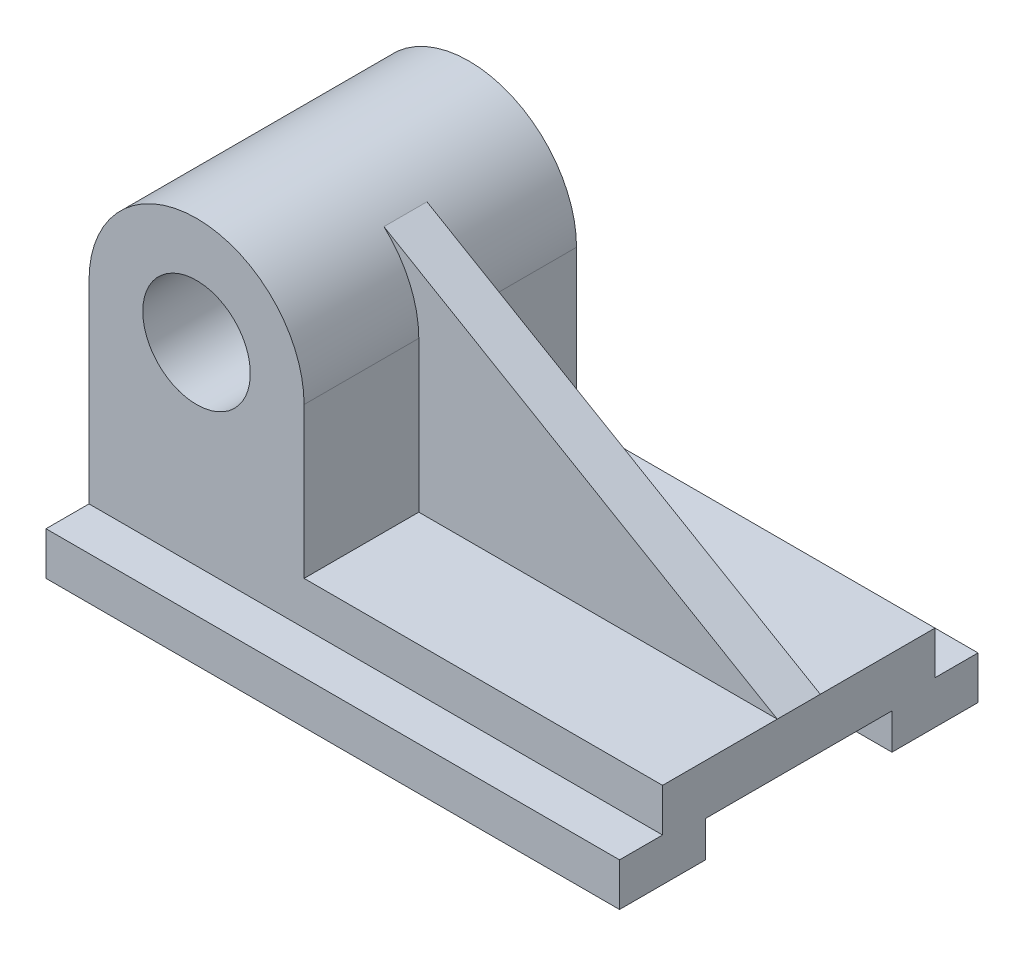
from build123d import *

# Parameters (mm, degrees)
SKETCH1_W                = 160
SKETCH1_H                = 100
BOSS_EXTRUDE2_DEPTH      = 24
SKETCH3_W                = 52
SKETCH3_H                = 10
CUT_EXTRUDE1_DEPTH       = 160
SKETCH4_W                = 12
SKETCH4_H                = 12
CUT_EXTRUDE2_DEPTH       = 160
SKETCH5_W                = 12
SKETCH5_H                = 12
CUT_EXTRUDE3_DEPTH       = 160
SKETCH6_R                = 15
BOSS_EXTRUDE3_DEPTH      = 76
BOSS_EXTRUDE4_DEPTH      = 6
BOSS_EXTRUDE4_DEPTH_BACK = 6


with BuildPart() as part:
    # Sketch1 → Boss-Extrude2 (new body)
    with BuildSketch(Plane(origin=(0, 0, 0), x_dir=(1, 0, 0), z_dir=(0, 1, 0))):
        Rectangle(SKETCH1_W, SKETCH1_H)
    extrude(amount=BOSS_EXTRUDE2_DEPTH)

    # Sketch3 → Cut-Extrude1 (cut)
    with BuildSketch(Plane(origin=(80, 0, 0), x_dir=(0, 0, -1), z_dir=(1, 0, 0))):
        with Locations((0, 5)):
            Rectangle(SKETCH3_W, SKETCH3_H)
    extrude(amount=-CUT_EXTRUDE1_DEPTH, mode=Mode.SUBTRACT)

    # Sketch4 → Cut-Extrude2 (cut)
    with BuildSketch(Plane(origin=(80, 0, 0), x_dir=(0, 0, -1), z_dir=(1, 0, 0))):
        with Locations((44, 18)):
            Rectangle(SKETCH4_W, SKETCH4_H)
    extrude(amount=-CUT_EXTRUDE2_DEPTH, mode=Mode.SUBTRACT)

    # Sketch5 → Cut-Extrude3 (cut)
    with BuildSketch(Plane(origin=(80, 0, 0), x_dir=(0, 0, -1), z_dir=(1, 0, 0))):
        with Locations((-44, 18)):
            Rectangle(SKETCH5_W, SKETCH5_H)
    extrude(amount=-CUT_EXTRUDE3_DEPTH, mode=Mode.SUBTRACT)

    # Sketch6 → Boss-Extrude3 (add)
    with BuildSketch(Plane(origin=(0, 0, -38), x_dir=(-1, 0, 0), z_dir=(0, 0, -1))):
        with BuildLine():
            Line((80, 24), (80, 66))
            ThreePointArc((80, 66), (50, 96), (20, 66))
            Line((20, 66), (20, 24))
            Line((20, 24), (80, 24))
        make_face()
        with Locations((50, 66)):
            Circle(SKETCH6_R, mode=Mode.SUBTRACT)
    extrude(amount=-BOSS_EXTRUDE3_DEPTH)

    # Sketch7 → Boss-Extrude4 (add, two sides: drawn at the far end of the back side and taken through both)
    with BuildSketch(Plane.XY.offset(-BOSS_EXTRUDE4_DEPTH_BACK)):
        with BuildLine():
            Line((-20, 24), (80, 24))
            Line((80, 24), (-29.728388886, 88.114741301))
            ThreePointArc((-29.728388886, 88.114741301), (-22.539589101, 78.079976543), (-20, 66))
            Line((-20, 66), (-20, 24))
        make_face()
    extrude(amount=BOSS_EXTRUDE4_DEPTH + BOSS_EXTRUDE4_DEPTH_BACK)


solid = part.part
